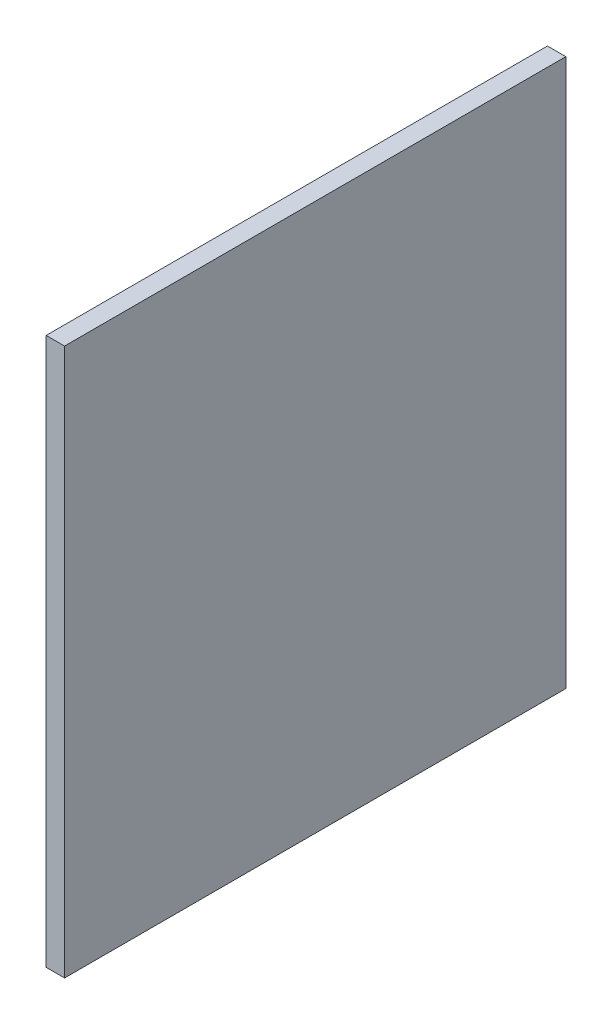
from build123d import *

# Parameters (mm, degrees)
SKETCH1_W           = 490
SKETCH1_H           = 535
BOSS_EXTRUDE1_DEPTH = 18


with BuildPart() as part:
    # Sketch1 → Boss-Extrude1 (new body)
    with BuildSketch(Plane(origin=(0, 0, 0), x_dir=(0, 0, -1), z_dir=(1, 0, 0))):
        with Locations((245, 267.5)):
            Rectangle(SKETCH1_W, SKETCH1_H)
    extrude(amount=BOSS_EXTRUDE1_DEPTH)


solid = part.part
